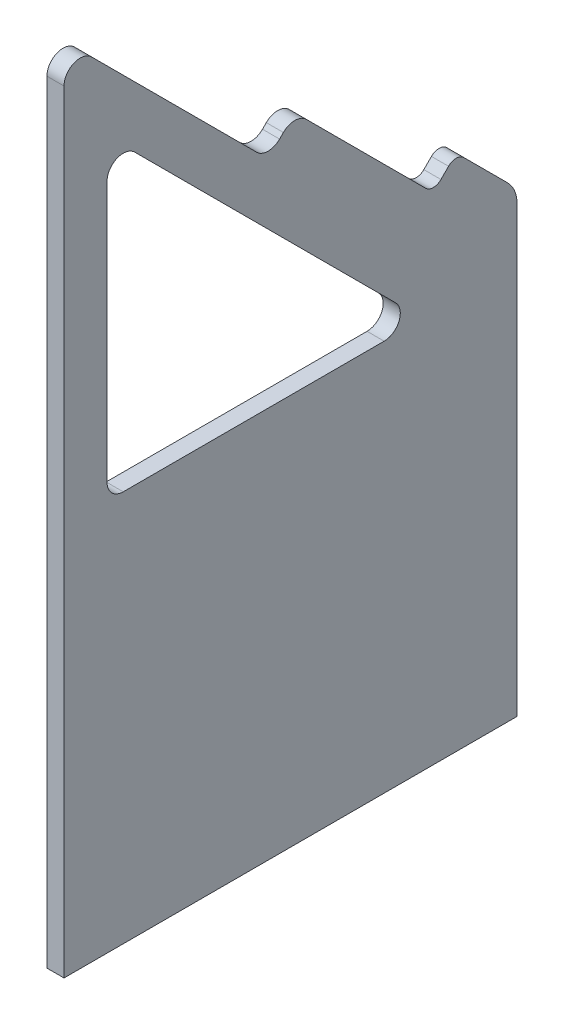
from build123d import *

# Parameters (mm, degrees)
BOSS_EXTRU_1_DEPTH      = 3.175
CONG_1_R                = 6
CONG_2_R                = 2
ENL_V_MAT_EXTRU_2_DEPTH = 157.50531659973907
CONG_4_R                = 3
BOSS_EXTRU_2_DEPTH      = 3.175
CONG_5_R                = 2
CONG_6_R                = 3


with BuildPart() as part:
    # Esquisse1 → Boss.-Extru.1 (new body)
    with BuildSketch(Plane(origin=(0, 0, 0), x_dir=(0, 0, -1), z_dir=(1, 0, 0))):
        Polygon((-42.0728534805994, 0), (42.0728534805994, 0), (42.072853480599385, 84.94974746830529), (30.759144981614714, 96.26345596728963), (26.516504294495412, 92.02081528017037), (33.58757210636085, 84.94974746830486), (28.637824638054987, 79.99999999999906), (-42.07285348059938, 150.71067811865416), align=None)
    extrude(amount=BOSS_EXTRU_1_DEPTH)

    # Congé1
    cong_1_edges = [part.edges().sort_by_distance(p)[0] for p in [
        (1.5875, 84.94974746830529, -42.072853480599385),
    ]]
    fillet(cong_1_edges, radius=CONG_1_R)

    # Congé2
    cong_2_edges = [part.edges().sort_by_distance(p)[0] for p in [
        (1.5875, 92.02081528017037, -26.516504294495412),
        (1.5875, 96.26345596728963, -30.759144981614714),
    ]]
    fillet(cong_2_edges, radius=CONG_2_R)

    # Esquisse4 → Enlèv. mat.-Extru.2 (cut, through all)
    with BuildSketch(Plane(origin=(3.175, 0, 0), x_dir=(0, 0, -1), z_dir=(1, 0, 0))):
        Polygon((24.62411613906931, 72.7), (-34.07285348059938, 72.69999999999999), (-34.07285348059938, 131.39696961966868), align=None)
    extrude(amount=-ENL_V_MAT_EXTRU_2_DEPTH, mode=Mode.SUBTRACT)

    # Congé4
    cong_4_edges = [part.edges().sort_by_distance(p)[0] for p in [
        (1.5875, 150.71067811865416, 42.07285348059938),
        (1.5875, 131.39696961966868, 34.07285348059938),
        (1.5875, 72.7, -24.62411613906931),
        (1.5875, 72.69999999999999, 34.07285348059938),
    ]]
    fillet(cong_4_edges, radius=CONG_4_R)

    # Esquisse5 → Boss.-Extru.2 (add)
    with BuildSketch(Plane(origin=(3.175, 0, 0), x_dir=(0, 0, -1), z_dir=(1, 0, 0))):
        Polygon((30.759144981614842, 96.26345596728976), (26.51650429449542, 92.02081528017034), (0.7928932188133107, 117.74442635585244), (-4.15685424949237, 112.79467888754677), (28.637824638054987, 79.99999999999906), (37.8302127934801, 89.19238815542445), align=None)
    extrude(amount=-BOSS_EXTRU_2_DEPTH)

    # Congé5
    cong_5_edges = [part.edges().sort_by_distance(p)[0] for p in [
        (1.5875, 96.26345596728976, -30.759144981614842),
        (1.5875, 92.02081528017034, -26.51650429449542),
    ]]
    fillet(cong_5_edges, radius=CONG_5_R)

    # Congé6
    cong_6_edges = [part.edges().sort_by_distance(p)[0] for p in [
        (1.5875, 112.79467888754677, 4.15685424949237),
        (1.5875, 117.74442635585244, -0.7928932188133107),
    ]]
    fillet(cong_6_edges, radius=CONG_6_R)


solid = part.part
